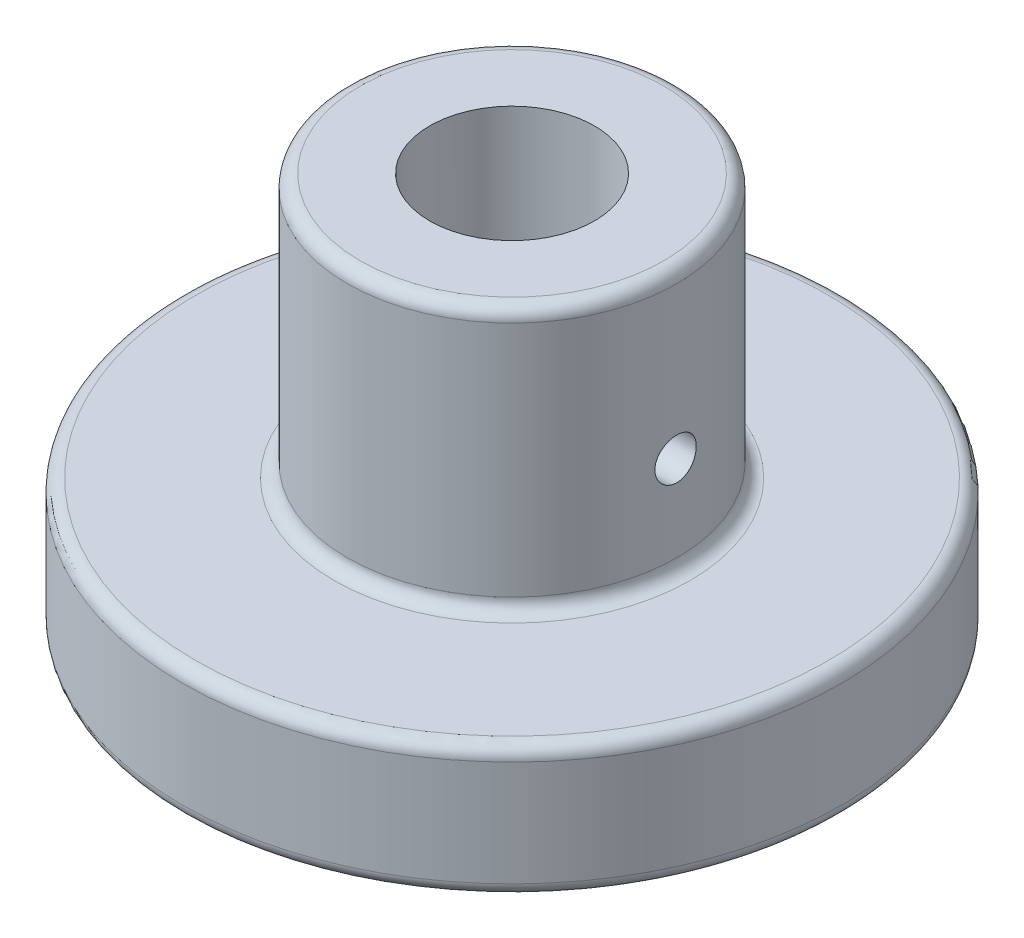
from build123d import *

# Parameters (mm, degrees)
SKETCH1_R           = 50
BOSS_EXTRUDE1_DEPTH = 20
SKETCH2_R           = 25
SKETCH2_R_2         = 12.5
BOSS_EXTRUDE2_DEPTH = 40
FILLET1_R           = 2
FILLET2_R           = 2
SKETCH3_R           = 3.136270049
CUT_EXTRUDE1_DEPTH  = 25


with BuildPart() as part:
    # Sketch1 → Boss-Extrude1 (new body)
    with BuildSketch(Plane(origin=(0, 0, 0), x_dir=(1, 0, 0), z_dir=(0, 1, 0))):
        with Locations(Location((0, 0, 0), (0, 0, 270))):
            Circle(SKETCH1_R)
    extrude(amount=BOSS_EXTRUDE1_DEPTH)

    # Sketch2 → Boss-Extrude2 (add)
    with BuildSketch(Plane(origin=(0, 20, 0), x_dir=(1, 0, 0), z_dir=(0, 1, 0))):
        with Locations(Location((0, 0, 0), (0, 0, 270))):
            Circle(SKETCH2_R)
        with Locations(Location((0, 0, 0), (0, 0, 270))):
            Circle(SKETCH2_R_2, mode=Mode.SUBTRACT)
    extrude(amount=BOSS_EXTRUDE2_DEPTH)

    # Fillet1
    fillet1_edges = [part.edges().sort_by_distance(p)[0] for p in [
        (0, 0, -50),
    ]]
    fillet(fillet1_edges, radius=FILLET1_R)

    # Fillet2
    fillet2_edges = [part.edges().sort_by_distance(p)[0] for p in [
        (0, 20, -50),
        (0, 60, -25),
        (0, 20, -25),
    ]]
    fillet(fillet2_edges, radius=FILLET2_R)

    # Sketch3 → Cut-Extrude1 (cut, symmetric)
    with BuildSketch(Plane(origin=(0, 0, 0), x_dir=(0, 0, -1), z_dir=(1, 0, 0))):
        with Locations((0, 35)):
            Circle(SKETCH3_R)
    extrude(amount=CUT_EXTRUDE1_DEPTH, both=True, mode=Mode.SUBTRACT)


solid = part.part
